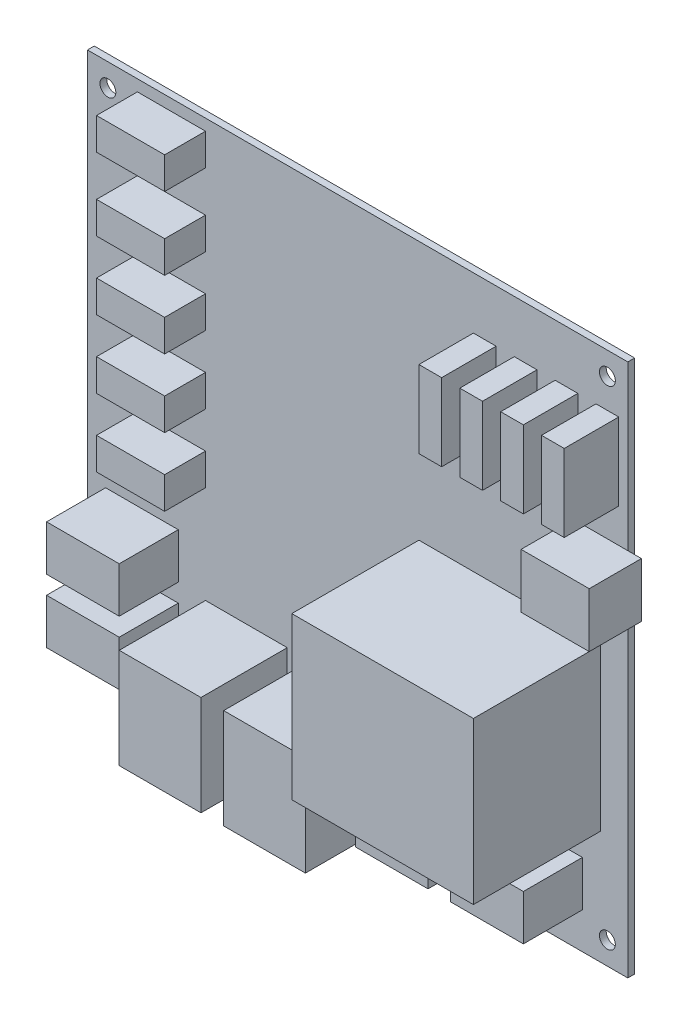
from build123d import *

# Parameters (mm, degrees)
SKETCH_1_W      = 119
SKETCH_1_H      = 117.5
SKETCH_1_R      = 1.75
EXTRUDE_1_DEPTH = 1.5
SKETCH_2_W      = 15
SKETCH_2_H      = 12
EXTRUDE_2_DEPTH = 11.5
SKETCH_4_W      = 40
SKETCH_4_H      = 35.5
EXTRUDE_3_DEPTH = 28
SKETCH_5_W      = 5
SKETCH_5_H      = 17
EXTRUDE_4_DEPTH = 12
SKETCH_6_W      = 16
SKETCH_6_H      = 10
EXTRUDE_5_DEPTH = 13
SKETCH_7_W      = 18
SKETCH_7_H      = 22
EXTRUDE_6_DEPTH = 19
SKETCH_8_W      = 15
SKETCH_8_H      = 7
EXTRUDE_7_DEPTH = 9
SKETCH_9_W      = 16
SKETCH_9_H      = 10
EXTRUDE_9_DEPTH = 13


with BuildPart() as part:
    # Эскиз1 → Бобышка-Вытянуть1 (new body)
    with BuildSketch(Plane.XY):
        with Locations((32.702043262, -23.462126246)):
            Rectangle(SKETCH_1_W, SKETCH_1_H)
        with Locations((-22.297956738, 30.287873754)):
            Circle(SKETCH_1_R, mode=Mode.SUBTRACT)
        with Locations((87.702043262, 30.287873754)):
            Circle(SKETCH_1_R, mode=Mode.SUBTRACT)
        with Locations((87.702043262, -77.212126246)):
            Circle(SKETCH_1_R, mode=Mode.SUBTRACT)
        with Locations((-22.297956738, -77.212126246)):
            Circle(SKETCH_1_R, mode=Mode.SUBTRACT)
    extrude(amount=EXTRUDE_1_DEPTH)

    # Эскиз2 → Бобышка-Вытянуть2 (add)
    with BuildSketch(Plane.XY.offset(1.5)):
        with Locations((87.702043262, -6.712126246)):
            Rectangle(SKETCH_2_W, SKETCH_2_H)
    extrude(amount=EXTRUDE_2_DEPTH)

    # Эскиз4 → Бобышка-Вытянуть3 (add)
    with BuildSketch(Plane.XY.offset(1.5)):
        with Locations((66.202043262, -39.462126246)):
            Rectangle(SKETCH_4_W, SKETCH_4_H)
    extrude(amount=EXTRUDE_3_DEPTH)

    # Эскиз5 → Бобышка-Вытянуть4 (add)
    with BuildSketch(Plane.XY.offset(1.5)):
        with Locations((87.702043262, 15.287873754)):
            Rectangle(SKETCH_5_W, SKETCH_5_H)
        with Locations((78.702043262, 15.287873754)):
            Rectangle(SKETCH_5_W, SKETCH_5_H)
        with Locations((69.702043262, 15.287873754)):
            Rectangle(SKETCH_5_W, SKETCH_5_H)
        with Locations((60.702043262, 15.287873754)):
            Rectangle(SKETCH_5_W, SKETCH_5_H)
    extrude(amount=EXTRUDE_4_DEPTH)

    # Эскиз6 → Бобышка-Вытянуть5 (add)
    with BuildSketch(Plane.XY.offset(1.5)):
        with Locations((53.202043262, -69.212126246)):
            Rectangle(SKETCH_6_W, SKETCH_6_H)
        with Locations((74.202043262, -69.212126246)):
            Rectangle(SKETCH_6_W, SKETCH_6_H)
    extrude(amount=EXTRUDE_5_DEPTH)

    # Эскиз7 → Бобышка-Вытянуть6 (add)
    with BuildSketch(Plane.XY.offset(1.5)):
        with Locations((31.202043262, -67.712126246)):
            Rectangle(SKETCH_7_W, SKETCH_7_H)
        with Locations((8.202043262, -67.712126246)):
            Rectangle(SKETCH_7_W, SKETCH_7_H)
    extrude(amount=EXTRUDE_6_DEPTH)

    # Эскиз8 → Бобышка-Вытянуть7 (add)
    with BuildSketch(Plane.XY.offset(1.5)):
        with Locations((-8.297956738, 13.287873754)):
            Rectangle(SKETCH_8_W, SKETCH_8_H)
        with Locations((-8.297956738, -1.712126246)):
            Rectangle(SKETCH_8_W, SKETCH_8_H)
        with Locations((-8.297956738, -16.712126246)):
            Rectangle(SKETCH_8_W, SKETCH_8_H)
        with Locations((-8.297956738, -31.712126246)):
            Rectangle(SKETCH_8_W, SKETCH_8_H)
        with Locations((-8.297956738, 29.287873754)):
            Rectangle(SKETCH_8_W, SKETCH_8_H)
    extrude(amount=EXTRUDE_7_DEPTH)

    # Эскиз9 → Бобышка-Вытянуть9 (add)
    with BuildSketch(Plane.XY.offset(1.5)):
        with Locations((-14.797956738, -51.212126246)):
            Rectangle(SKETCH_9_W, SKETCH_9_H)
        with Locations((-14.797956738, -65.212126246)):
            Rectangle(SKETCH_9_W, SKETCH_9_H)
    extrude(amount=EXTRUDE_9_DEPTH)


solid = part.part
